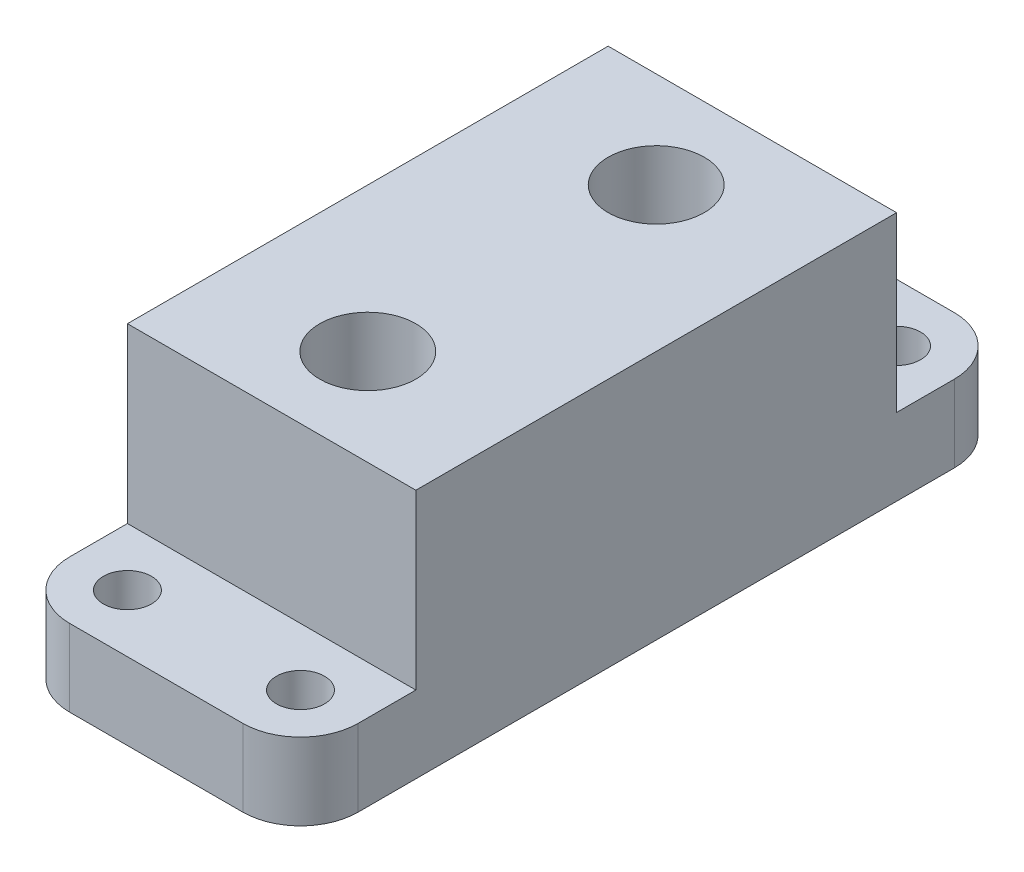
from build123d import *

# Parameters (mm, degrees)
SKETCH_1_W          = 65
SKETCH_1_H          = 25
EXTRUDE_1_DEPTH     = 4
SKETCH_2_W          = 15
SKETCH_2_H          = 25
EXTRUDE_2_DEPTH     = 13
SKETCH_3_R          = 2.5
SKETCH_3_R_2        = 4
CUT_EXTRUDE_1_DEPTH = 39.74919354
SKETCH_5_W          = 15
SKETCH_5_H          = 4
EXTRUDE_3_DEPTH     = 6
SKETCH_6_R          = 1.25
CUT_EXTRUDE_3_DEPTH = 40.59166579
FILLET_2_R          = 3
CUT_EXTRUDE_4_DEPTH = 49.023431781


with BuildPart() as part:
    # 草图1 → 凸台-拉伸1 (new body)
    with BuildSketch(Plane(origin=(0, 0, 0), x_dir=(1, 0, 0), z_dir=(0, 1, 0))):
        Rectangle(SKETCH_1_W, SKETCH_1_H)
    extrude(amount=EXTRUDE_1_DEPTH)

    # 草图2 → 凸台-拉伸2 (add)
    with BuildSketch(Plane(origin=(0, 4, 0), x_dir=(1, 0, 0), z_dir=(0, 1, 0))):
        Rectangle(SKETCH_2_W, SKETCH_2_H)
    extrude(amount=EXTRUDE_2_DEPTH)

    # 草图3 → 切除-拉伸1 (cut, through all)
    with BuildSketch(Plane.XZ):
        with Locations(Location((0, -7.5, 0), (0, 0, 270))):
            Circle(SKETCH_3_R)
        with Locations(Location((0, 7.5, 0), (0, 0, 90))):
            Circle(SKETCH_3_R)
        with Locations(Location((-22, 0, 0), (0, 0, 270))):
            Circle(SKETCH_3_R_2)
        with Locations(Location((22, 0, 0), (0, 0, 90))):
            Circle(SKETCH_3_R_2)
    extrude(amount=-CUT_EXTRUDE_1_DEPTH, mode=Mode.SUBTRACT)

    # 草图5 → 凸台-拉伸3 (add)
    with BuildSketch(Plane.XY.offset(12.5)):
        with Locations((0, 6)):
            Rectangle(SKETCH_5_W, SKETCH_5_H)
    extrude_3 = extrude(amount=EXTRUDE_3_DEPTH)

    # 草图6 → 切除-拉伸3 (cut, through all)
    with BuildSketch(Plane.XZ.offset(-4)):
        with Locations(Location((-4.5, 15.5, 0), (0, 0, 270))):
            Circle(SKETCH_6_R)
        with Locations(Location((4.5, 15.5, 0), (0, 0, 270))):
            Circle(SKETCH_6_R)
    cut_extrude_3 = extrude(amount=-CUT_EXTRUDE_3_DEPTH, mode=Mode.SUBTRACT)

    # 镜向2: 凸台-拉伸3, 切除-拉伸3 across plane
    add(extrude_3.mirror(Plane.XY))
    add(cut_extrude_3.mirror(Plane.XY), mode=Mode.SUBTRACT)

    # 圆角2
    fillet_2_edges = [part.edges().sort_by_distance(p)[0] for p in [
        (-7.5, 6, 18.5),
        (7.5, 6, 18.5),
        (-7.5, 6, -18.5),
        (7.5, 6, -18.5),
    ]]
    fillet(fillet_2_edges, radius=FILLET_2_R)

    # 草图7 → 切除-拉伸4 (cut, through all)
    with BuildSketch(Plane(origin=(0, 0, -12.5), x_dir=(-1, 0, 0), z_dir=(0, 0, -1))):
        Polygon((32.5, 4), (7.5, 4), (-7.5, 4), (-32.5, 4), (-32.5, 0), (32.5, 0), align=None)
    extrude(amount=-CUT_EXTRUDE_4_DEPTH, mode=Mode.SUBTRACT)


solid = part.part
